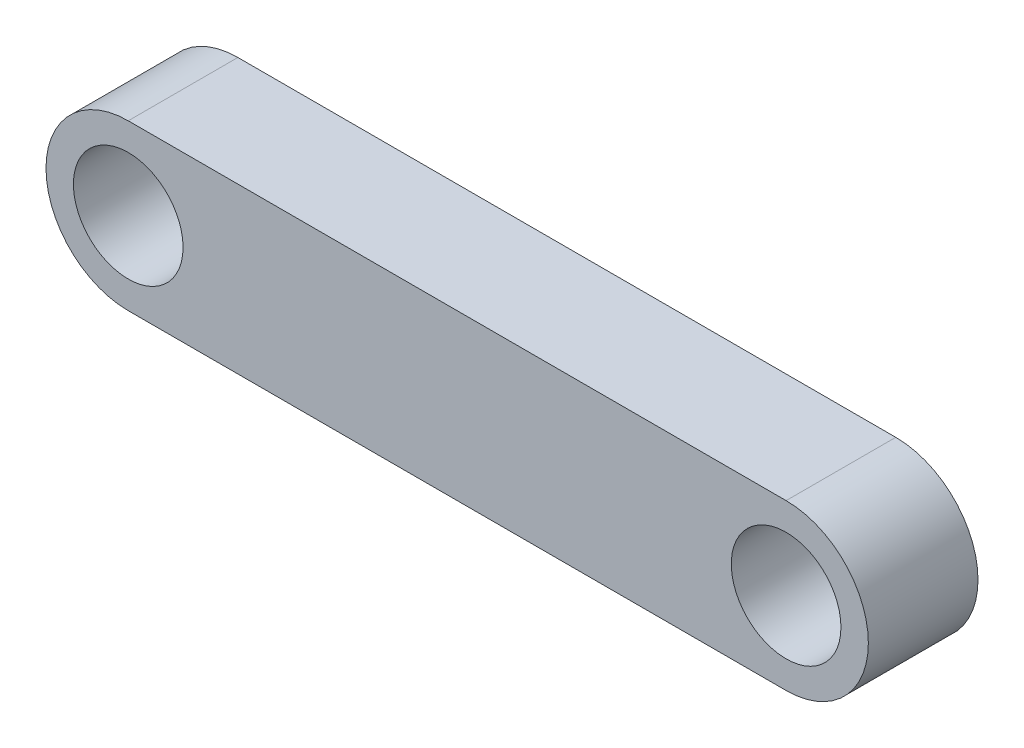
from build123d import *

# Parameters (mm, degrees)
CROQUIS1_R              = 5
SALIENTE_EXTRUIR1_DEPTH = 10


with BuildPart() as part:
    # Croquis1 → Saliente-Extruir1 (new body)
    with BuildSketch(Plane.XY):
        with BuildLine():
            Line((0, 7.5), (60, 7.5))
            ThreePointArc((60, 7.5), (67.5, 0), (60, -7.5))
            Line((60, -7.5), (0, -7.5))
            ThreePointArc((0, -7.5), (-7.5, 0), (0, 7.5))
        make_face()
        Circle(CROQUIS1_R, mode=Mode.SUBTRACT)
        with Locations((60, 0)):
            Circle(CROQUIS1_R, mode=Mode.SUBTRACT)
    extrude(amount=SALIENTE_EXTRUIR1_DEPTH)


solid = part.part
